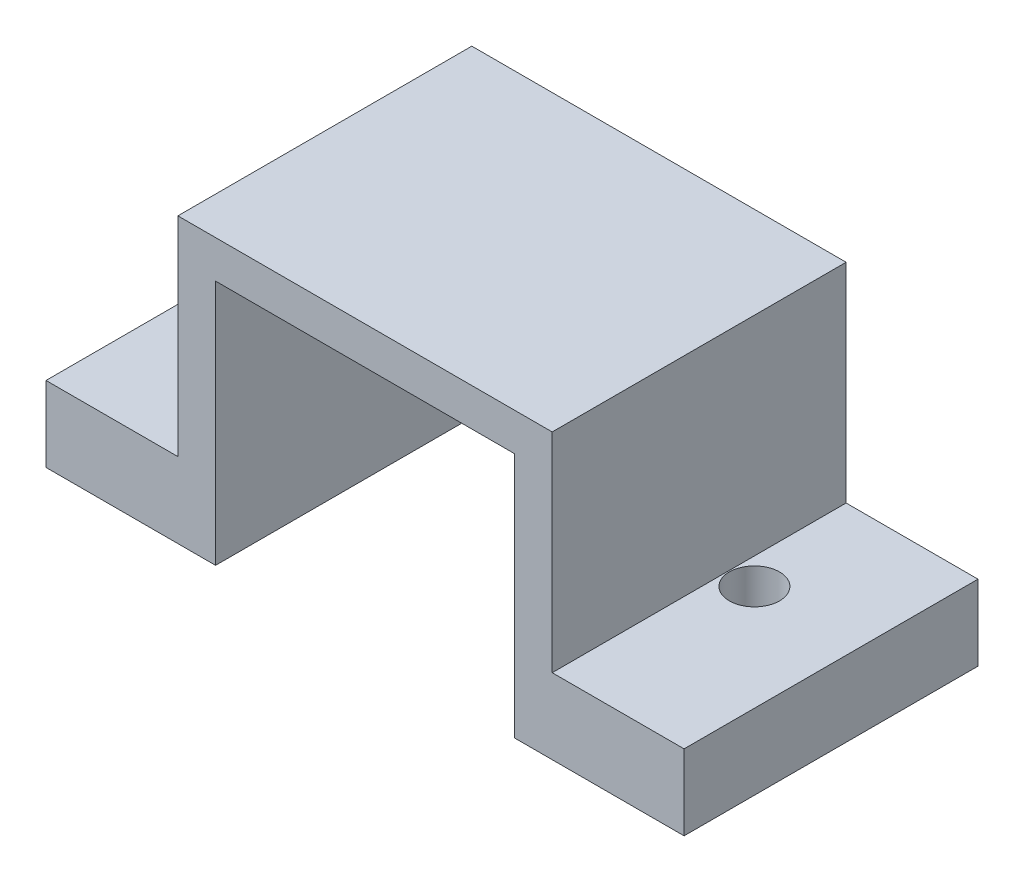
from build123d import *

# Parameters (mm, degrees)
CROQUIS1_W              = 25.4
CROQUIS1_H              = 11.3
SALIENTE_EXTRUIR1_DEPTH = 11.7
CROQUIS2_W              = 5.25
CROQUIS2_H              = 11.7
CORTAR_EXTRUIR1_DEPTH   = 8.3
CROQUIS3_W              = 11.9
CROQUIS3_H              = 9.8
CORTAR_EXTRUIR2_DEPTH   = 31.161896492
CROQUIS4_R              = 1
CORTAR_EXTRUIR3_DEPTH   = 30.170875887


with BuildPart() as part:
    # Croquis1 → Saliente-Extruir1 (new body)
    with BuildSketch(Plane.XY):
        with Locations((12.7, 5.65)):
            Rectangle(CROQUIS1_W, CROQUIS1_H)
    extrude(amount=SALIENTE_EXTRUIR1_DEPTH)

    # Croquis2 → Cortar-Extruir1 (cut)
    with BuildSketch(Plane(origin=(0, 11.3, 0), x_dir=(1, 0, 0), z_dir=(0, 1, 0))):
        with Locations((2.625, -5.85)):
            Rectangle(CROQUIS2_W, CROQUIS2_H)
        with Locations((22.775, -5.85)):
            Rectangle(CROQUIS2_W, CROQUIS2_H)
    extrude(amount=-CORTAR_EXTRUIR1_DEPTH, mode=Mode.SUBTRACT)

    # Croquis3 → Cortar-Extruir2 (cut, through all)
    with BuildSketch(Plane.XY.offset(11.7)):
        with Locations((12.7, 4.9)):
            Rectangle(CROQUIS3_W, CROQUIS3_H)
    extrude(amount=-CORTAR_EXTRUIR2_DEPTH, mode=Mode.SUBTRACT)

    # Croquis4 → Cortar-Extruir3 (cut, through all)
    with BuildSketch(Plane(origin=(0, 3, 0), x_dir=(1, 0, 0), z_dir=(0, 1, 0))):
        with Locations(Location((21.2, -4.7, 0), (0, 0, 270))):
            Circle(CROQUIS4_R)
        with Locations(Location((4.2, -4.7, 0), (0, 0, 270))):
            Circle(CROQUIS4_R)
    extrude(amount=-CORTAR_EXTRUIR3_DEPTH, mode=Mode.SUBTRACT)


solid = part.part
